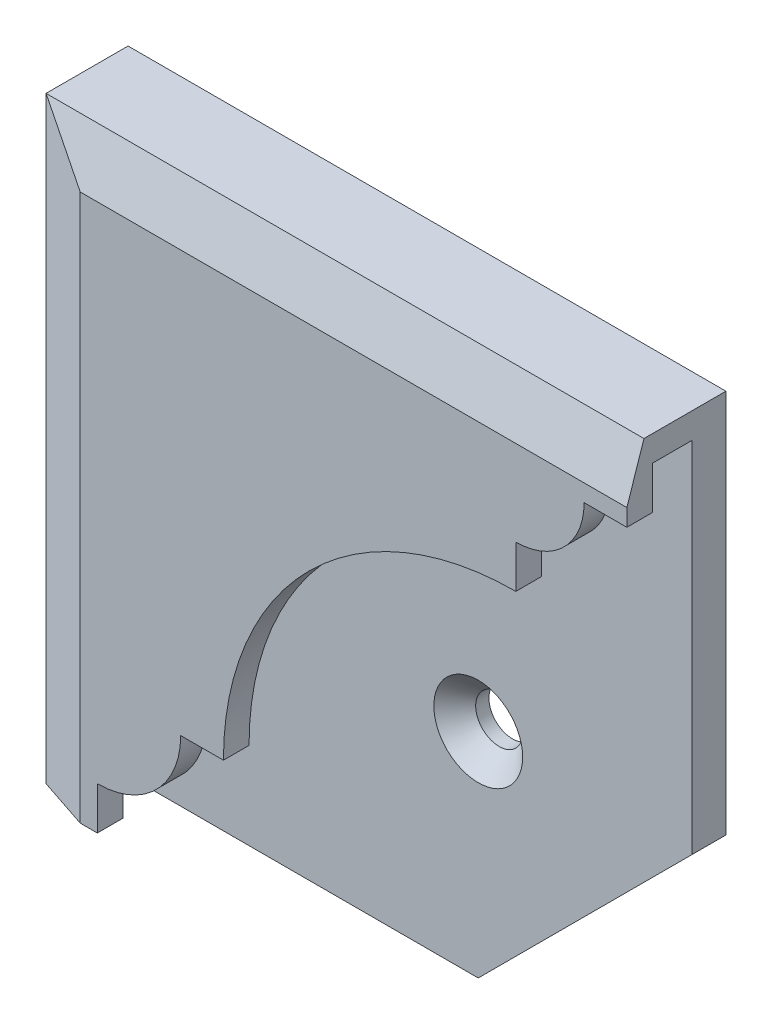
from build123d import *
from OCP.BRepFilletAPI import BRepFilletAPI_MakeChamfer

# Parameters (mm, degrees)
ESQUISSE1_W        = 70
ESQUISSE1_H        = 70
BOSS_EXTRU_1_DEPTH = 4
BOSS_EXTRU_2_DEPTH = 4.6
BOSS_EXTRU_3_DEPTH = 3
CHANFREIN1_SIZE    = 2
CHANFREIN1_SIZE2   = 6
CHANFREIN2_SIZE    = 25


with BuildPart() as part:
    # Esquisse1 → Boss.-Extru.1 (new body)
    with BuildSketch(Plane.XY):
        Rectangle(ESQUISSE1_W, ESQUISSE1_H)
    extrude(amount=BOSS_EXTRU_1_DEPTH)

    # Esquisse2 → Boss.-Extru.2 (add)
    with BuildSketch(Plane.XY.offset(4)):
        Polygon((-35, 35), (-35, -35), (-32, -35), (-32, 32), (35, 32), (35, 35), align=None)
    extrude(amount=BOSS_EXTRU_2_DEPTH)

    # Esquisse3 → Boss.-Extru.3 (add)
    with BuildSketch(Plane.XY.offset(8.6)):
        with BuildLine():
            Line((35, 35), (-35, 35))
            Line((-35, 35), (-35, -35))
            Line((-35, -35), (-27, -35))
            Line((-27, -35), (-27, -30))
            ThreePointArc((-27, -30), (-20.095113441, -27.13990234), (-17.235015781, -20.235015781))
            Line((-17.235015781, -20.235015781), (-12.235015781, -20.235015781))
            ThreePointArc((-12.235015781, -20.235015781), (-2.207811813, 3.972796032), (22, 14))
            Line((22, 14), (22, 19))
            ThreePointArc((22, 19), (27.656854249, 21.343145751), (30, 27))
            Line((30, 27), (35, 27))
            Line((35, 27), (35, 35))
        make_face()
    extrude(amount=BOSS_EXTRU_3_DEPTH)

    # Chanfrein1: one chamfer whose edges measure the first distance from different faces: ONE call of the kernel's chamfer builder (chamfer() names one face for all edges)
    chanfrein1_edges_1 = [part.edges().sort_by_distance(p)[0] for p in [
        (0, 35, 11.6),
    ]]
    chanfrein1_side_1 = [part.faces().sort_by_distance(p)[0] for p in [
        (0, 35, 5.8),
    ]]
    chanfrein1_edges_2 = [part.edges().sort_by_distance(p)[0] for p in [
        (-35, 0, 11.6),
    ]]
    chanfrein1_side_2 = [part.faces().sort_by_distance(p)[0] for p in [
        (-35, 0, 5.8),
    ]]
    chanfrein1 = BRepFilletAPI_MakeChamfer(part.part.solid().wrapped)
    for e in chanfrein1_edges_1:
        chanfrein1.Add(CHANFREIN1_SIZE, CHANFREIN1_SIZE2, e.wrapped, chanfrein1_side_1[0].wrapped)  # the first distance lies on this face
    for e in chanfrein1_edges_2:
        chanfrein1.Add(CHANFREIN1_SIZE, CHANFREIN1_SIZE2, e.wrapped, chanfrein1_side_2[0].wrapped)  # the first distance lies on this face
    add(Compound.cast(chanfrein1.Shape()), mode=Mode.REPLACE)

    # Chanfrein2
    chanfrein2_edges = [part.edges().sort_by_distance(p)[0] for p in [
        (35, -35, 2),
    ]]
    chamfer(chanfrein2_edges, length=CHANFREIN2_SIZE)

    # Esquisse4 → Fraisage pour vis à tête fraisée M51 (revolve, cut)
    with BuildSketch(Plane(origin=(10, -10, 4), x_dir=(0, -1, 0), z_dir=(1, 0, 0))):
        Polygon((0, 0), (0, 4), (2.75, 4), (2.75, 2.45), (5.2, 0), align=None)
    revolve(axis=Axis((10, -10, 10.35), (0, 0, -1)), mode=Mode.SUBTRACT)


solid = part.part
